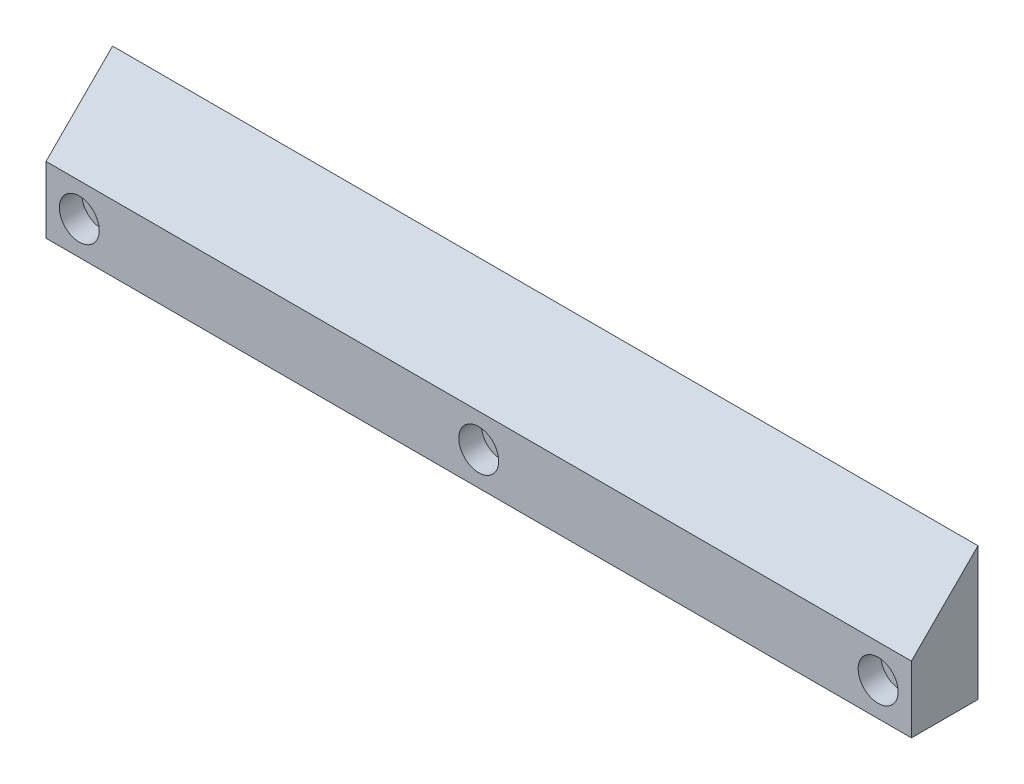
from build123d import *

# Parameters (mm, degrees)
SKETCH1_W                                            = 130
SKETCH1_H                                            = 10
BOSS_EXTRUDE1_DEPTH                                  = 10
CBORE_FOR_M3_HEXAGON_SOCKET_HEAD_CAP_SCR_D           = 3.2
CBORE_FOR_M3_HEXAGON_SOCKET_HEAD_CAP_SCR_CBORE_D     = 6
CBORE_FOR_M3_HEXAGON_SOCKET_HEAD_CAP_SCR_CBORE_DEPTH = 3.4
BOSS_EXTRUDE2_DEPTH                                  = 130


with BuildPart() as part:
    # Sketch1 → Boss-Extrude1 (new body)
    with BuildSketch(Plane.XY):
        with Locations((0, 5)):
            Rectangle(SKETCH1_W, SKETCH1_H)
    extrude(amount=BOSS_EXTRUDE1_DEPTH)

    # CBORE for M3 Hexagon socket head cap screws1 (through all)
    with Locations(Plane.XY.offset(10)):
        with Locations((-60, 5), (0, 5), (60, 5)):
            CounterBoreHole(CBORE_FOR_M3_HEXAGON_SOCKET_HEAD_CAP_SCR_D / 2, CBORE_FOR_M3_HEXAGON_SOCKET_HEAD_CAP_SCR_CBORE_D / 2, CBORE_FOR_M3_HEXAGON_SOCKET_HEAD_CAP_SCR_CBORE_DEPTH)

    # Sketch4 → Boss-Extrude2 (add)
    with BuildSketch(Plane.ZY.offset(65)):
        Polygon((10, 10), (0, 10), (0, 20), align=None)
    extrude(amount=-BOSS_EXTRUDE2_DEPTH)


solid = part.part
